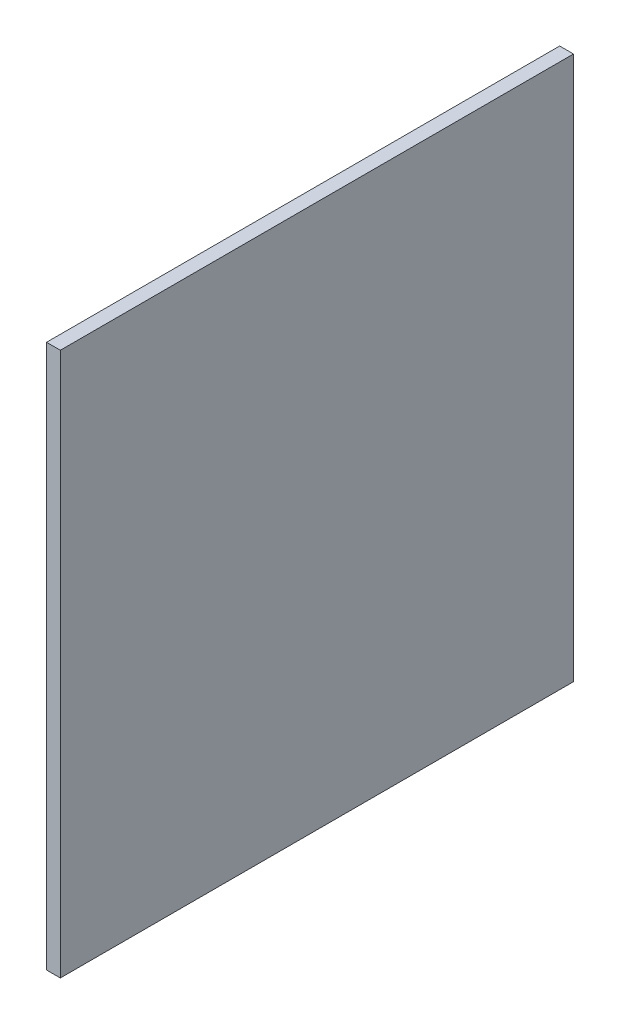
from build123d import *

# Parameters (mm, degrees)
SKETCH1_W           = 353.95
SKETCH1_H           = 375
BOSS_EXTRUDE1_DEPTH = 9.525


with BuildPart() as part:
    # Sketch1 → Boss-Extrude1 (new body)
    with BuildSketch(Plane(origin=(0, 0, 0), x_dir=(0, 0, -1), z_dir=(1, 0, 0))):
        with Locations((176.975, 187.5)):
            Rectangle(SKETCH1_W, SKETCH1_H)
    extrude(amount=BOSS_EXTRUDE1_DEPTH)


solid = part.part
